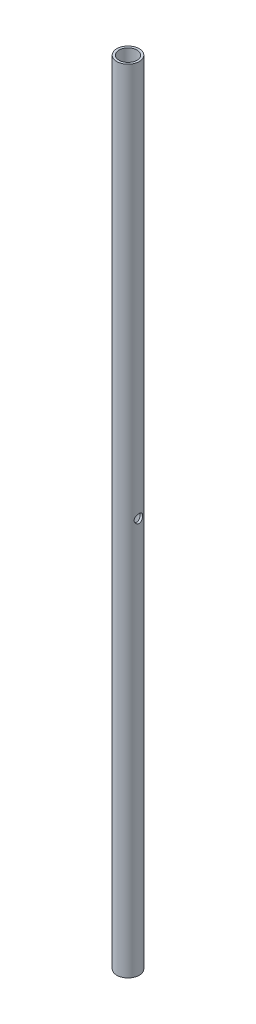
from build123d import *

# Parameters (mm, degrees)
SKETCH1_R               = 16.7005
SKETCH1_R_2             = 13.335
BOSS_EXTRUDE1_DEPTH     = 520.7
BOSS_EXTRUDE2_START     = 660.4
SKETCH3_R               = 16.7005
SKETCH3_R_2             = 13.335
BOSS_EXTRUDE2_DEPTH     = 660.4
CUT_EXTRUDE1_DEPTH      = 661.822194997
CUT_EXTRUDE1_DEPTH_BACK = 661.822194997
SKETCH2_R               = 6.35


with BuildPart() as part:
    # Sketch1 → Boss-Extrude1 (new body)
    with BuildSketch(Plane(origin=(0, 0, 0), x_dir=(1, 0, 0), z_dir=(0, 1, 0))):
        with Locations(Location((0, 0, 0), (0, 0, 270))):
            Circle(SKETCH1_R)
        with Locations(Location((0, 0, 0), (0, 0, 270))):
            Circle(SKETCH1_R_2, mode=Mode.SUBTRACT)
    extrude(amount=BOSS_EXTRUDE1_DEPTH)

    # Sketch3 → Boss-Extrude2 (add)
    with BuildSketch(Plane.XZ.offset(BOSS_EXTRUDE2_START)):
        with Locations(Location((0, 0, 0), (0, 0, 270))):
            Circle(SKETCH3_R)
        with Locations(Location((0, 0, 0), (0, 0, 270))):
            Circle(SKETCH3_R_2, mode=Mode.SUBTRACT)
    extrude(amount=-BOSS_EXTRUDE2_DEPTH)

    # Sketch2 → Cut-Extrude1 (cut, two sides: drawn at the far end of the back side and taken through both)
    with BuildSketch(Plane(origin=(0, 0, 0), x_dir=(0, 0, -1), z_dir=(1, 0, 0)).offset(-CUT_EXTRUDE1_DEPTH_BACK)):
        with Locations((0, -69.85)):
            Circle(SKETCH2_R)
    extrude(amount=CUT_EXTRUDE1_DEPTH + CUT_EXTRUDE1_DEPTH_BACK, mode=Mode.SUBTRACT)


solid = part.part
